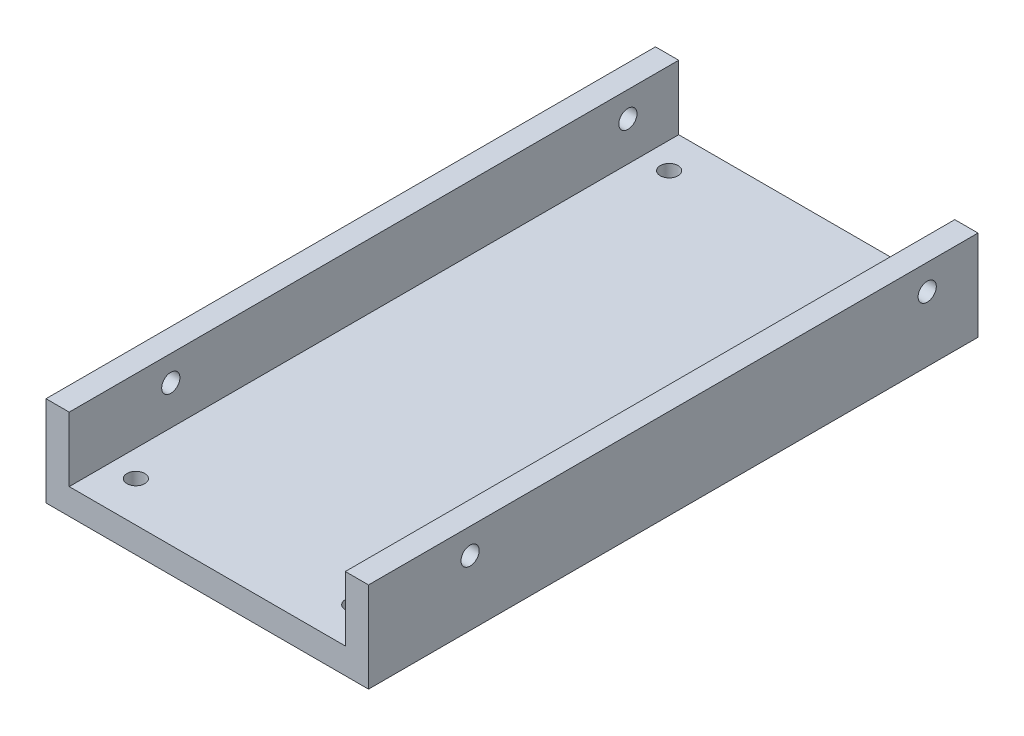
from build123d import *

# Parameters (mm, degrees)
SKETCH2_W           = 63.5
SKETCH2_H           = 120
BOSS_EXTRUDE1_DEPTH = 5.08
SKETCH3_W           = 4.572
SKETCH3_H           = 120
BOSS_EXTRUDE2_DEPTH = 12.7
CUT_EXTRUDE1_REACH  = 120.329
SKETCH4_R           = 1.79097934
SKETCH5_R           = 1.75
CUT_EXTRUDE2_DEPTH  = 114.146112049


with BuildPart() as part:
    # Sketch2 → Boss-Extrude1 (new body)
    with BuildSketch(Plane(origin=(0, 0, 0), x_dir=(1, 0, 0), z_dir=(0, 1, 0))):
        with Locations((-21.471987722, 38.251383169)):
            Rectangle(SKETCH2_W, SKETCH2_H)
    extrude(amount=BOSS_EXTRUDE1_DEPTH)

    # Sketch3 → Boss-Extrude2 (add)
    with BuildSketch(Plane(origin=(0, 5.08, 0), x_dir=(1, 0, 0), z_dir=(0, 1, 0))):
        with Locations((-50.935987722, 38.251383169)):
            Rectangle(SKETCH3_W, SKETCH3_H)
        with Locations((7.992012278, 38.251383169)):
            Rectangle(SKETCH3_W, SKETCH3_H)
    extrude(amount=BOSS_EXTRUDE2_DEPTH)

    # Cut-Extrude1: up to this face of the body (flat: up to its plane)
    cut_extrude1_end = Plane(part.part.faces().sort_by_distance((-53.221987722, 8.89, -38.251383169))[0])
    # Sketch4 → Cut-Extrude1 (cut, up to the picked face)
    with BuildSketch(Plane(origin=(10.278012278, 0, 0), x_dir=(0, 0, -1), z_dir=(1, 0, 0)), mode=Mode.PRIVATE) as cut_extrude1_sk1:
        with Locations((-1.748616831, 12.78)):
            Circle(SKETCH4_R)
    cut_extrude1_tool1 = split(extrude(cut_extrude1_sk1.sketch, amount=-CUT_EXTRUDE1_REACH, mode=Mode.PRIVATE), bisect_by=cut_extrude1_end, keep=Keep.BOTH, mode=Mode.PRIVATE)
    # Sketch4 → Cut-Extrude1 (cut, up to the picked face)
    with BuildSketch(Plane(origin=(10.278012278, 0, 0), x_dir=(0, 0, -1), z_dir=(1, 0, 0)), mode=Mode.PRIVATE) as cut_extrude1_sk2:
        with Locations((88.251383169, 12.78)):
            Circle(SKETCH4_R)
    cut_extrude1_tool2 = split(extrude(cut_extrude1_sk2.sketch, amount=-CUT_EXTRUDE1_REACH, mode=Mode.PRIVATE), bisect_by=cut_extrude1_end, keep=Keep.BOTH, mode=Mode.PRIVATE)
    add(cut_extrude1_tool1.solids().sort_by(Axis((10.278012, 12.78, 1.748617), (-1, 0, 0)))[0], mode=Mode.SUBTRACT)
    add(cut_extrude1_tool2.solids().sort_by(Axis((10.278012, 12.78, -88.251383), (-1, 0, 0)))[0], mode=Mode.SUBTRACT)

    # Sketch5 → Cut-Extrude2 (cut, through all)
    with BuildSketch(Plane(origin=(0, 0, 0), x_dir=(-1, 0, 0), z_dir=(0, -1, 0))):
        with Locations(Location((43.456413511, 91.179295555, 0), (0, 0, 90))):
            Circle(SKETCH5_R)
        with Locations(Location((0.456413511, 91.179295555, 0), (0, 0, 90))):
            Circle(SKETCH5_R)
        with Locations(Location((43.456413511, -13.820704445, 0), (0, 0, 90))):
            Circle(SKETCH5_R)
        with Locations(Location((0.456413511, -13.820704445, 0), (0, 0, 90))):
            Circle(SKETCH5_R)
    extrude(amount=-CUT_EXTRUDE2_DEPTH, mode=Mode.SUBTRACT)


solid = part.part
